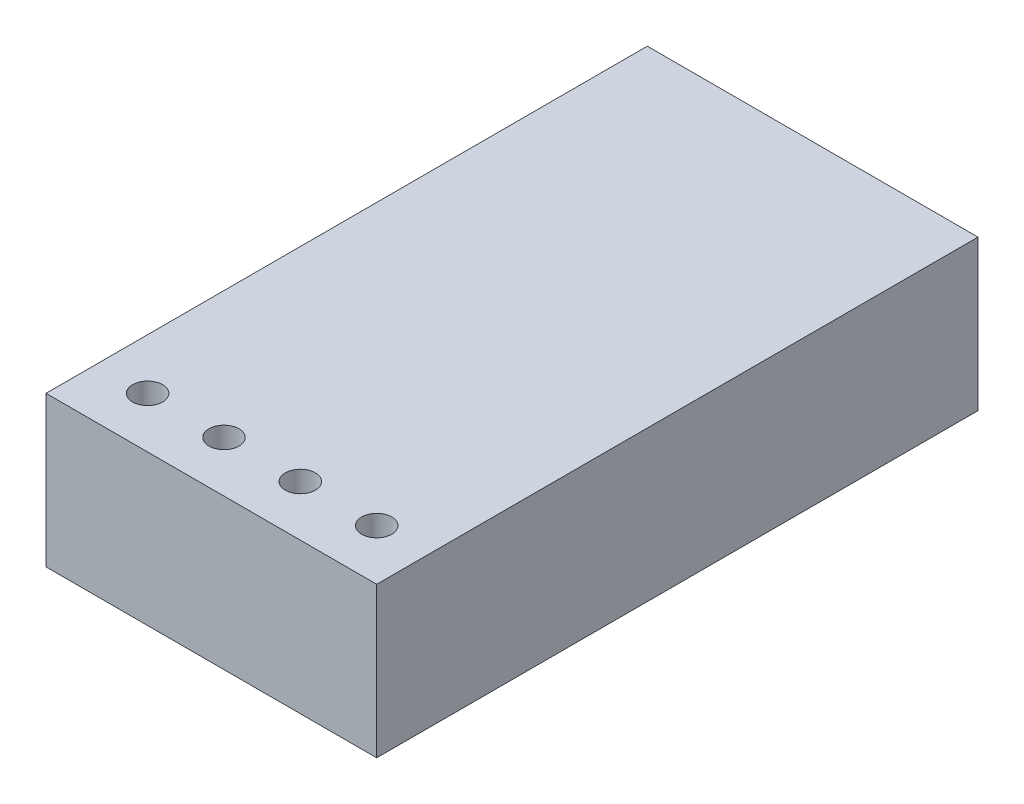
from build123d import *

# Parameters (mm, degrees)
SKETCH1_W           = 11
SKETCH1_H           = 20
SKETCH1_R           = 0.5
BOSS_EXTRUDE1_DEPTH = 5


with BuildPart() as part:
    # Sketch1 → Boss-Extrude1 (new body)
    with BuildSketch(Plane(origin=(0, 0, 0), x_dir=(1, 0, 0), z_dir=(0, 1, 0))):
        Rectangle(SKETCH1_W, SKETCH1_H)
        with Locations(Location((-3.81, -8.31, 0), (0, 0, 270))):
            Circle(SKETCH1_R, mode=Mode.SUBTRACT)
        with Locations(Location((-1.27, -8.31, 0), (0, 0, 270))):
            Circle(SKETCH1_R, mode=Mode.SUBTRACT)
        with Locations(Location((1.27, -8.31, 0), (0, 0, 270))):
            Circle(SKETCH1_R, mode=Mode.SUBTRACT)
        with Locations(Location((3.81, -8.31, 0), (0, 0, 270))):
            Circle(SKETCH1_R, mode=Mode.SUBTRACT)
    extrude(amount=BOSS_EXTRUDE1_DEPTH)


solid = part.part
